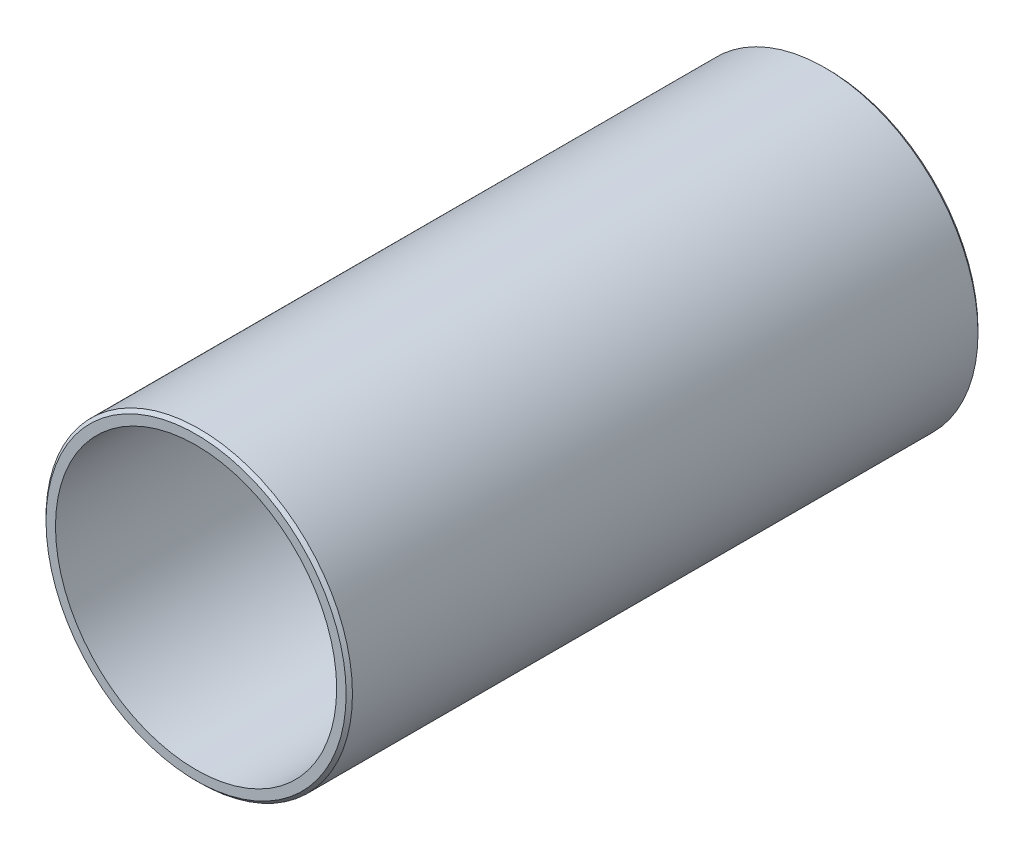
from build123d import *

# Parameters (mm, degrees)
SKETCH_2_R      = 97
SKETCH_2_R_2    = 89
EXTRUDE_1_DEPTH = 200
CHAMFER_1_SIZE  = 2


with BuildPart() as part:
    # 草图2 → 凸台-拉伸1 (new, symmetric)
    with BuildSketch(Plane.XY):
        Circle(SKETCH_2_R)
        Circle(SKETCH_2_R_2, mode=Mode.SUBTRACT)
    extrude(amount=EXTRUDE_1_DEPTH, both=True)

    # 倒角1
    chamfer_1_edges = [part.edges().sort_by_distance(p)[0] for p in [
        (-97, 0, -200),
        (-97, 0, 200),
    ]]
    chamfer(chamfer_1_edges, length=CHAMFER_1_SIZE)


solid = part.part
